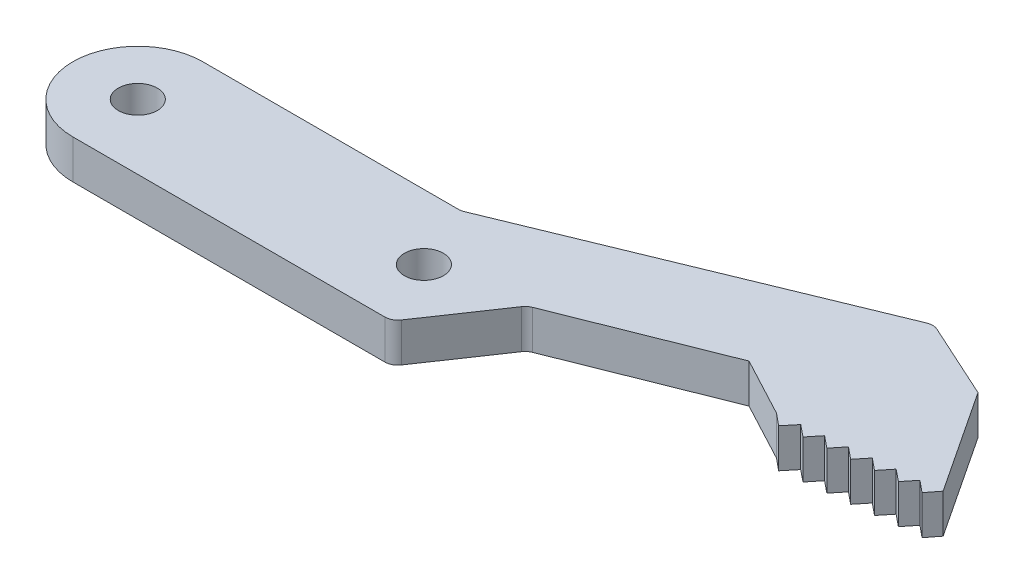
from build123d import *

# Parameters (mm, degrees)
SKETCH1_R           = 1.5
BOSS_EXTRUDE1_DEPTH = 3


with BuildPart() as part:
    # Sketch1 → Boss-Extrude1 (new body)
    with BuildSketch(Plane(origin=(0, 0, 0), x_dir=(1, 0, 0), z_dir=(0, 1, 0))):
        with BuildLine():
            Line((0, -5), (23.998875872, -5))
            ThreePointArc((23.998875872, -5), (24.467345461, -4.883479623), (24.826642543, -4.561072489))
            Line((24.826642543, -4.561072489), (28.564941326, 0.954149161))
            ThreePointArc((28.564941326, 0.954149161), (28.766036178, 1.172359953), (29.022312673, 1.321950886))
            Line((29.022312673, 1.321950886), (40.929553216, 6.070049343))
            Line((40.929553216, 6.070049343), (45.451842333, 3.660227249))
            Line((45.451842333, 3.660227249), (46.37900311, 2.898073771))
            Line((46.37900311, 2.898073771), (47.144586244, 3.829406729))
            Line((47.144586244, 3.829406729), (48.06174016, 3.086958957))
            Line((48.06174016, 3.086958957), (48.804187932, 4.004112872))
            Line((48.804187932, 4.004112872), (49.721341848, 3.2616651))
            Line((49.721341848, 3.2616651), (50.46378962, 4.178819016))
            Line((50.46378962, 4.178819016), (51.380943536, 3.436371244))
            Line((51.380943536, 3.436371244), (52.123391308, 4.35352516))
            Line((52.123391308, 4.35352516), (53.040545224, 3.611077387))
            Line((53.040545224, 3.611077387), (53.782992996, 4.528231303))
            Line((53.782992996, 4.528231303), (54.700146912, 3.785783531))
            Line((54.700146912, 3.785783531), (55.442594685, 4.702937447))
            Line((55.442594685, 4.702937447), (56.34448506, 3.957791721))
            Line((56.34448506, 3.957791721), (57.05438411, 4.868693049))
            Line((57.05438411, 4.868693049), (51.831402108, 12.774604725))
            Line((51.831402108, 12.774604725), (46.024183924, 15.419882568))
            ThreePointArc((46.024183924, 15.419882568), (45.628323444, 15.509674561), (45.229386093, 15.434727162))
            Line((45.229386093, 15.434727162), (20.032711481, 5.075121772))
            ThreePointArc((20.032711481, 5.075121772), (19.846254378, 5.018960187), (19.652448068, 5))
            Line((19.652448068, 5), (0, 5))
            ThreePointArc((0, 5), (-5, 0), (0, -5))
        make_face()
        with Locations(Location((0, 0, 0), (0, 0, 270))):
            Circle(SKETCH1_R, mode=Mode.SUBTRACT)
        with Locations(Location((22, 0, 0), (0, 0, 270))):
            Circle(SKETCH1_R, mode=Mode.SUBTRACT)
    extrude(amount=BOSS_EXTRUDE1_DEPTH)


solid = part.part
